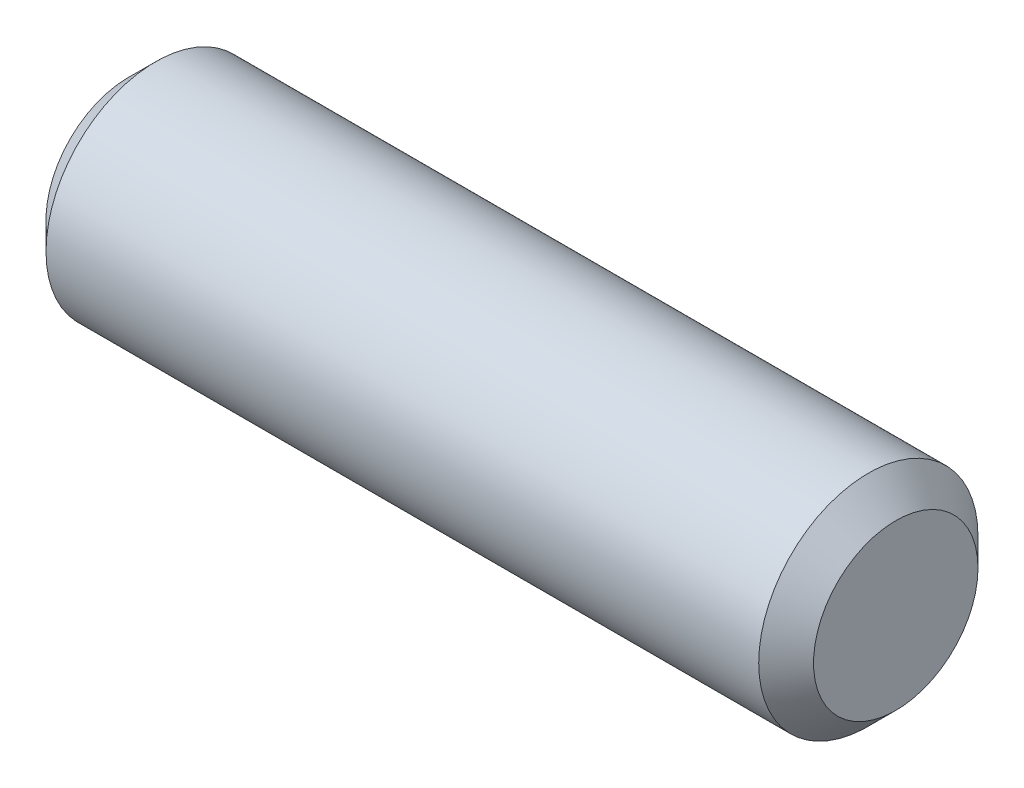
from build123d import *

# Parameters (mm, degrees)
ESBO_O1_R                = 2
RESSALTO_EXTRUS_O1_DEPTH = 14
CHANFRO1_SIZE            = 0.5


with BuildPart() as part:
    # Esboço1 → Ressalto-extrusão1 (new body)
    with BuildSketch(Plane(origin=(0, 0, 0), x_dir=(0, 0, -1), z_dir=(1, 0, 0))):
        Circle(ESBO_O1_R)
    extrude(amount=RESSALTO_EXTRUS_O1_DEPTH)

    # Chanfro1
    chanfro1_edges = [part.edges().sort_by_distance(p)[0] for p in [
        (0, 0, 2),
        (14, 0, 2),
    ]]
    chamfer(chanfro1_edges, length=CHANFRO1_SIZE)


solid = part.part
